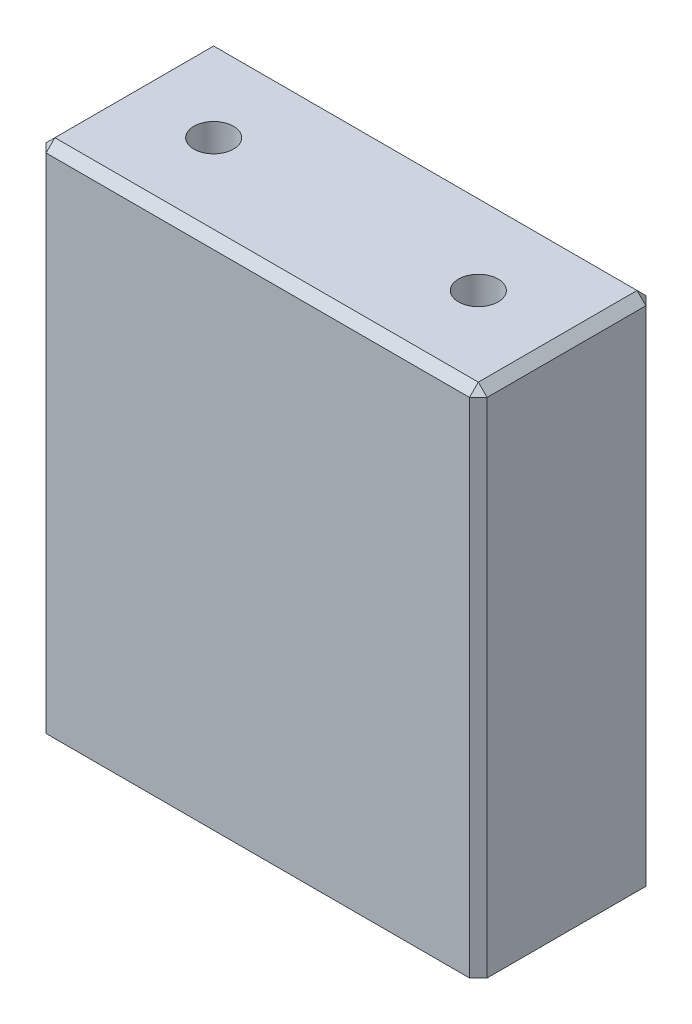
from build123d import *

# Parameters (mm, degrees)
SKETCH1_W           = 50
SKETCH1_H           = 58
BOSS_EXTRUDE1_DEPTH = 20
SKETCH2_R           = 2.25
CUT_EXTRUDE1_DEPTH  = 86.813751812
SKETCH3_W           = 44
SKETCH3_H           = 14
CUT_EXTRUDE2_DEPTH  = 53
CHAMFER1_SIZE       = 1


with BuildPart() as part:
    # Sketch1 → Boss-Extrude1 (new body)
    with BuildSketch(Plane.XY):
        with Locations((35, 29)):
            Rectangle(SKETCH1_W, SKETCH1_H)
    extrude(amount=BOSS_EXTRUDE1_DEPTH)

    # Sketch2 → Cut-Extrude1 (cut, through all)
    with BuildSketch(Plane(origin=(0, 58, 0), x_dir=(1, 0, 0), z_dir=(0, 1, 0))):
        with Locations(Location((20, -10, 0), (0, 0, 180))):
            Circle(SKETCH2_R)
        with Locations(Location((50, -10, 0), (0, 0, 180))):
            Circle(SKETCH2_R)
    extrude(amount=-CUT_EXTRUDE1_DEPTH, mode=Mode.SUBTRACT)

    # Sketch3 → Cut-Extrude2 (cut)
    with BuildSketch(Plane.XZ):
        with Locations((35, 10)):
            Rectangle(SKETCH3_W, SKETCH3_H)
    extrude(amount=-CUT_EXTRUDE2_DEPTH, mode=Mode.SUBTRACT)

    # Chamfer1
    chamfer1_edges = [part.edges().sort_by_distance(p)[0] for p in [
        (60, 29, 20),
        (35, 58, 20),
        (60, 29, 0),
        (10, 29, 0),
        (35, 58, 0),
        (60, 58, 10),
        (10, 58, 10),
        (10, 29, 20),
    ]]
    chamfer(chamfer1_edges, length=CHAMFER1_SIZE)


solid = part.part
